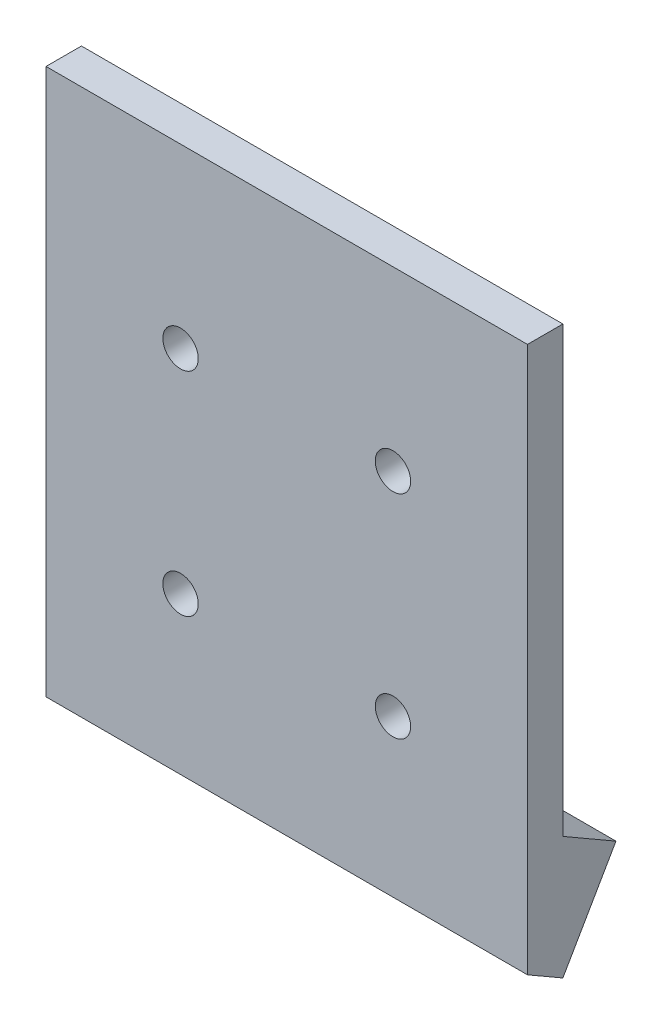
from build123d import *

# Parameters (mm, degrees)
SKETCH1_W           = 86.36
SKETCH1_H           = 101.6
SKETCH1_R           = 3.175
BOSS_EXTRUDE1_DEPTH = 6.35
CUT_EXTRUDE1_DEPTH  = 101.394283204
BOSS_EXTRUDE2_DEPTH = 86.36
SKETCH4_R           = 2.1828125
CUT_EXTRUDE2_DEPTH  = 104.736983459


with BuildPart() as part:
    # Sketch1 → Boss-Extrude1 (new body)
    with BuildSketch(Plane.XY):
        Rectangle(SKETCH1_W, SKETCH1_H)
        with Locations((-19.05, 19.05)):
            Circle(SKETCH1_R, mode=Mode.SUBTRACT)
        with Locations((19.05, 19.05)):
            Circle(SKETCH1_R, mode=Mode.SUBTRACT)
        with Locations((-19.05, -19.05)):
            Circle(SKETCH1_R, mode=Mode.SUBTRACT)
        with Locations((19.05, -19.05)):
            Circle(SKETCH1_R, mode=Mode.SUBTRACT)
    extrude(amount=BOSS_EXTRUDE1_DEPTH)

    # Sketch2 → Cut-Extrude1 (cut, through all)
    with BuildSketch(Plane(origin=(43.18, 0, 0), x_dir=(0, 0, -1), z_dir=(1, 0, 0))):
        Polygon((0, -50.8), (-6.35, -47.133825791), (-6.35, -50.8), align=None)
    extrude(amount=-CUT_EXTRUDE1_DEPTH, mode=Mode.SUBTRACT)

    # Sketch3 → Boss-Extrude2 (add, through all)
    with BuildSketch(Plane(origin=(43.18, 0, 0), x_dir=(0, 0, -1), z_dir=(1, 0, 0))):
        Polygon((0, -50.8), (9.525, -34.302216058), (0, -28.802954744), align=None)
    extrude(amount=-BOSS_EXTRUDE2_DEPTH)

    # Sketch4 → Cut-Extrude2 (cut, through all)
    with BuildSketch(Plane(origin=(0, -38.1, 21.997045256), x_dir=(-1, 0, 0), z_dir=(0, -0.8660254037844419, 0.4999999999999946))):
        with Locations(Location((31.75, 21.733825791, 0), (0, 0, 90))):
            Circle(SKETCH4_R)
        with Locations(Location((-31.75, 21.733825791, 0), (0, 0, 90))):
            Circle(SKETCH4_R)
    extrude(amount=-CUT_EXTRUDE2_DEPTH, mode=Mode.SUBTRACT)


solid = part.part
